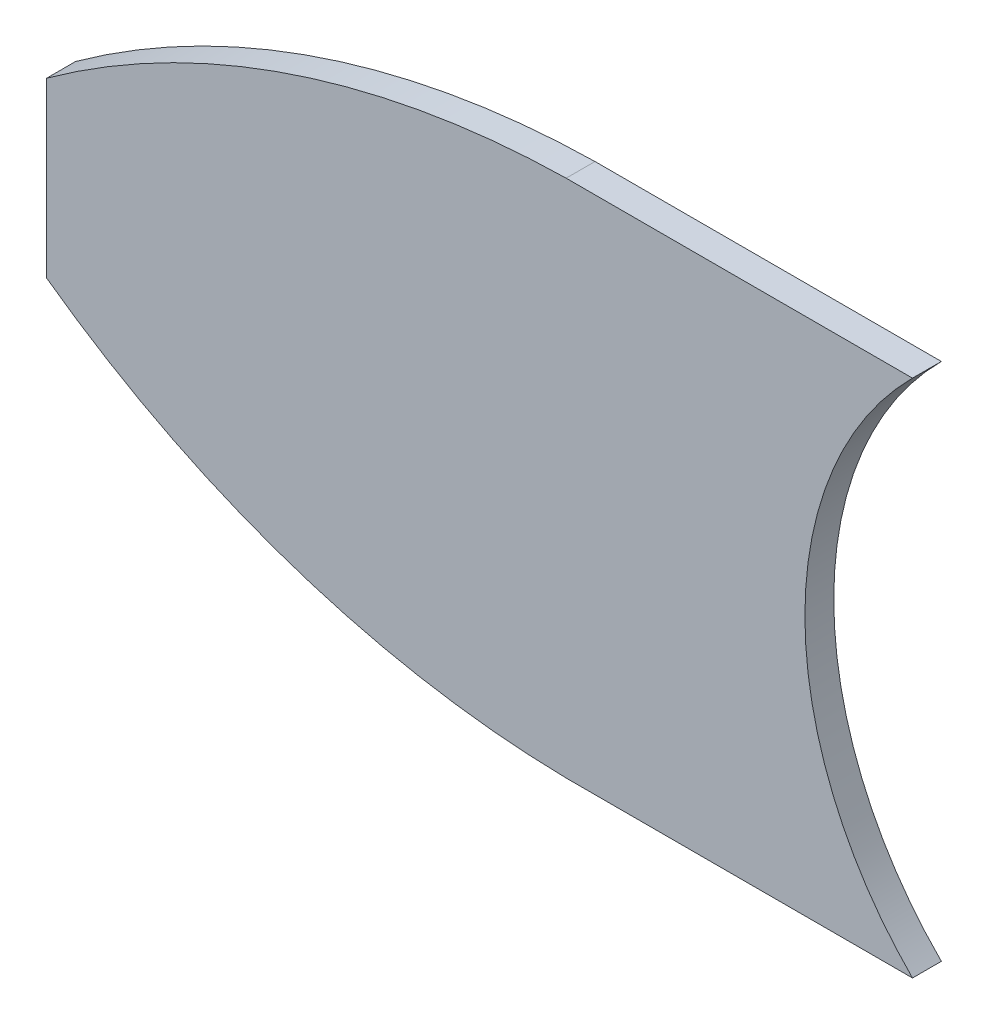
from build123d import *

# Parameters (mm, degrees)
BOSS_EXTRUDE1_DEPTH = 10


with BuildPart() as part:
    # Sketch1 → Boss-Extrude1 (new body)
    with BuildSketch(Plane.XY):
        with BuildLine():
            Line((0, 0), (-120, 0))
            ThreePointArc((-120, 0), (-214.59995491, 16.200135269), (-300, 60))
            Line((-300, 60), (-300, 120))
            ThreePointArc((-300, 120), (-214.59995491, 163.799864731), (-120, 180))
            Line((-120, 180), (0, 180))
            ThreePointArc((0, 180), (-37.279220614, 90), (0, 0))
        make_face()
    extrude(amount=BOSS_EXTRUDE1_DEPTH)


solid = part.part
